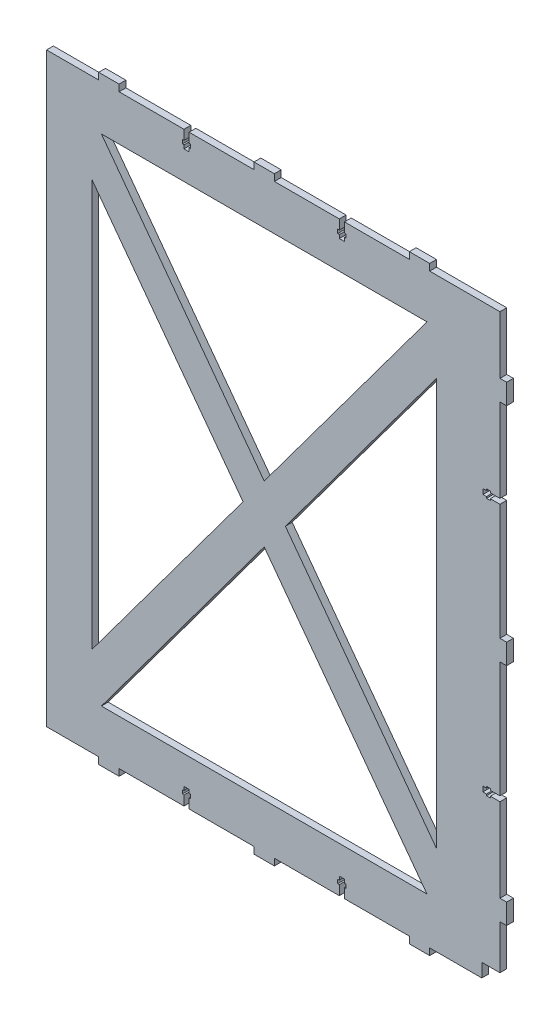
from build123d import *

# Parameters (mm, degrees)
EXTRUDE_1_DEPTH            = 6
EXTRUDE_1_DEPTH_BACK       = 0.0001
SKETCH_1_W                 = 384.2
SKETCH_1_H                 = 517.4
SKETCH_2562_W              = 18
SKETCH_2562_H              = 6.2
EXTRUDE_2573_DEPTH         = 6
CUT_EXTRUDE_4_DEPTH        = 716.027083403
CUT_EXTRUDE_4_DEPTH_BACK   = 716.027083403
SKETCH_2698_W              = 17
SKETCH_2698_H              = 505.4
EXTRUDE_2764_DEPTH         = 6
SKETCH_2820_W              = 6.2
SKETCH_2820_H              = 18
EXTRUDE_2968_DEPTH         = 6
CUT_EXTRUDE_4_2_DEPTH      = 736.415052878
CUT_EXTRUDE_4_2_DEPTH_BACK = 736.415052878


with BuildPart() as part:
    # Эскиз1 → Бобышка-Вытянуть1 (new, two sides: drawn at the far end of the back side and taken through both)
    with BuildSketch(Plane.XY.offset(-EXTRUDE_1_DEPTH_BACK)):
        with Locations((472.1, -0.1)):
            Rectangle(SKETCH_1_W, SKETCH_1_H)
        Polygon((624.2, 179.571602285), (490.783243916, -0.1), (624.2, -179.771602285), align=None, mode=Mode.SUBTRACT)
        Polygon((615.81439814, 218.6), (472.1, 25.060620516), (328.38560186, 218.6), align=None, mode=Mode.SUBTRACT)
        Polygon((615.81439814, -218.8), (328.38560186, -218.8), (472.1, -25.260620516), align=None, mode=Mode.SUBTRACT)
        Polygon((320, 179.571602285), (320, -179.771602285), (453.416756084, -0.1), align=None, mode=Mode.SUBTRACT)
    extrude(amount=EXTRUDE_1_DEPTH + EXTRUDE_1_DEPTH_BACK)

    # Sketch 2562 → Extrude 2573 (add)
    with BuildSketch(Plane.XY):
        with Locations((335, -261.6)):
            Rectangle(SKETCH_2562_W, SKETCH_2562_H)
        with Locations((472.1, -261.6)):
            Rectangle(SKETCH_2562_W, SKETCH_2562_H)
        with Locations((609.2, -261.6)):
            Rectangle(SKETCH_2562_W, SKETCH_2562_H)
        with Locations((335, 261.4)):
            Rectangle(SKETCH_2562_W, SKETCH_2562_H)
        with Locations((472.1, 261.4)):
            Rectangle(SKETCH_2562_W, SKETCH_2562_H)
        with Locations((609.2, 261.4)):
            Rectangle(SKETCH_2562_W, SKETCH_2562_H)
    extrude(amount=EXTRUDE_2573_DEPTH)

    # Sketch 4 → Cut-Extrude 4 (cut, two sides: drawn at the far end of the back side and taken through both)
    with BuildSketch(Plane.XY.offset(-CUT_EXTRUDE_4_DEPTH_BACK)):
        Polygon((401.3, -259.8), (405.8, -259.8), (405.8, -250.3), (407.2, -250.3), (407.2, -246.9), (405.8, -246.9), (405.8, -243.8), (401.3, -243.8), (401.3, -246.9), (399.9, -246.9), (399.9, -250.3), (401.3, -250.3), align=None)
        Polygon((538.4, -259.8), (542.9, -259.8), (542.9, -250.3), (544.3, -250.3), (544.3, -246.9), (542.9, -246.9), (542.9, -243.8), (538.4, -243.8), (538.4, -246.9), (537, -246.9), (537, -250.3), (538.4, -250.3), align=None)
        Polygon((401.3, 259.6), (405.8, 259.6), (405.8, 250.1), (407.2, 250.1), (407.2, 246.7), (405.8, 246.7), (405.8, 243.6), (401.3, 243.6), (401.3, 246.7), (399.9, 246.7), (399.9, 250.1), (401.3, 250.1), align=None)
        Polygon((538.4, 259.6), (542.9, 259.6), (542.9, 250.1), (544.3, 250.1), (544.3, 246.7), (542.9, 246.7), (542.9, 243.6), (538.4, 243.6), (538.4, 246.7), (537, 246.7), (537, 250.1), (538.4, 250.1), align=None)
    extrude(amount=CUT_EXTRUDE_4_DEPTH + CUT_EXTRUDE_4_DEPTH_BACK, mode=Mode.SUBTRACT)

    # Sketch 2698 → Extrude 2764 (add)
    with BuildSketch(Plane.XY):
        with Locations((671.7, 5.9)):
            Rectangle(SKETCH_2698_W, SKETCH_2698_H)
    extrude(amount=EXTRUDE_2764_DEPTH)

    # Sketch 2820 → Extrude 2968 (add)
    with BuildSketch(Plane.XY):
        with Locations((683, -198.8)):
            Rectangle(SKETCH_2820_W, SKETCH_2820_H)
        with Locations((683, -0.1)):
            Rectangle(SKETCH_2820_W, SKETCH_2820_H)
        with Locations((683, 198.6)):
            Rectangle(SKETCH_2820_W, SKETCH_2820_H)
    extrude(amount=EXTRUDE_2968_DEPTH)

    # Sketch 4 2 → Cut-Extrude 4 2 (cut, two sides: drawn at the far end of the back side and taken through both)
    with BuildSketch(Plane.XY.offset(-CUT_EXTRUDE_4_2_DEPTH_BACK)):
        Polygon((681.2, -116.05), (681.2, -111.55), (671.7, -111.55), (671.7, -110.15), (668.3, -110.15), (668.3, -111.55), (665.2, -111.55), (665.2, -116.05), (668.3, -116.05), (668.3, -117.45), (671.7, -117.45), (671.7, -116.05), align=None)
        Polygon((681.2, 111.35), (681.2, 115.85), (671.7, 115.85), (671.7, 117.25), (668.3, 117.25), (668.3, 115.85), (665.2, 115.85), (665.2, 111.35), (668.3, 111.35), (668.3, 109.95), (671.7, 109.95), (671.7, 111.35), align=None)
    extrude(amount=CUT_EXTRUDE_4_2_DEPTH + CUT_EXTRUDE_4_2_DEPTH_BACK, mode=Mode.SUBTRACT)


solid = part.part
